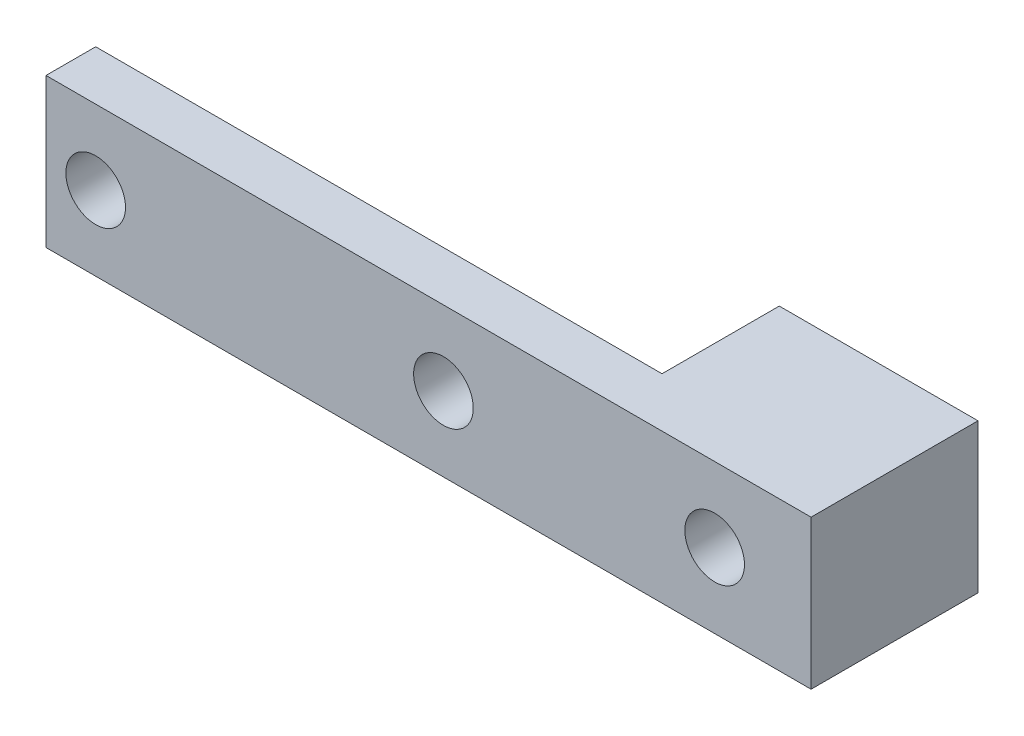
from build123d import *

# Parameters (mm, degrees)
BOSS_EXTRUDE1_DEPTH = 2.5
BOSS_EXTRUDE2_START = 5.9
SKETCH2_W           = 10
SKETCH2_H           = 7.5
SKETCH2_R           = 1.5
BOSS_EXTRUDE2_DEPTH = 5.9


with BuildPart() as part:
    # Sketch1 → Boss-Extrude1 (new body)
    with BuildSketch(Plane(origin=(0, 0, 0), x_dir=(0, 1, 0), z_dir=(0, 0, 1))):
        with BuildLine():
            Line((0, 18.25), (0, 19.25))
            Line((0, 19.25), (-3.75, 19.25))
            Line((-3.75, 19.25), (-3.75, -19.25))
            Line((-3.75, -19.25), (0, -19.25))
            Line((0, -19.25), (0, -15.898))
            ThreePointArc((0, -15.898), (-1.5, -14.398), (0, -12.898))
            Line((0, -12.898), (0, -2.25))
            ThreePointArc((0, -2.25), (-1.5, -0.75), (0, 0.75))
            Line((0, 0.75), (0, 15.25))
            ThreePointArc((0, 15.25), (-1.5, 16.75), (0, 18.25))
        make_face()
        with BuildLine():
            Line((3.75, 19.25), (0, 19.25))
            Line((0, 19.25), (0, 18.25))
            ThreePointArc((0, 18.25), (1.060660172, 17.810660172), (1.5, 16.75))
            ThreePointArc((1.5, 16.75), (1.060660172, 15.689339828), (0, 15.25))
            Line((0, 15.25), (0, 0.75))
            ThreePointArc((0, 0.75), (1.060660172, 0.310660172), (1.5, -0.75))
            ThreePointArc((1.5, -0.75), (1.060660172, -1.810660172), (0, -2.25))
            Line((0, -2.25), (0, -12.898))
            ThreePointArc((0, -12.898), (1.060660172, -13.337339828), (1.5, -14.398))
            ThreePointArc((1.5, -14.398), (1.060660172, -15.458660172), (0, -15.898))
            Line((0, -15.898), (0, -19.25))
            Line((0, -19.25), (3.75, -19.25))
            Line((3.75, -19.25), (3.75, 19.25))
        make_face()
    extrude(amount=BOSS_EXTRUDE1_DEPTH)

    # Sketch2 → Boss-Extrude2 (add)
    with BuildSketch(Plane(origin=(0, 0, 0), x_dir=(1, 0, 0), z_dir=(0, 0, -1)).offset(BOSS_EXTRUDE2_START)):
        with Locations((14.25, 0)):
            Rectangle(SKETCH2_W, SKETCH2_H)
        with Locations(Location((14.398, 0, 0), (0, 0, 180))):
            Circle(SKETCH2_R, mode=Mode.SUBTRACT)
    extrude(amount=-BOSS_EXTRUDE2_DEPTH)


solid = part.part
